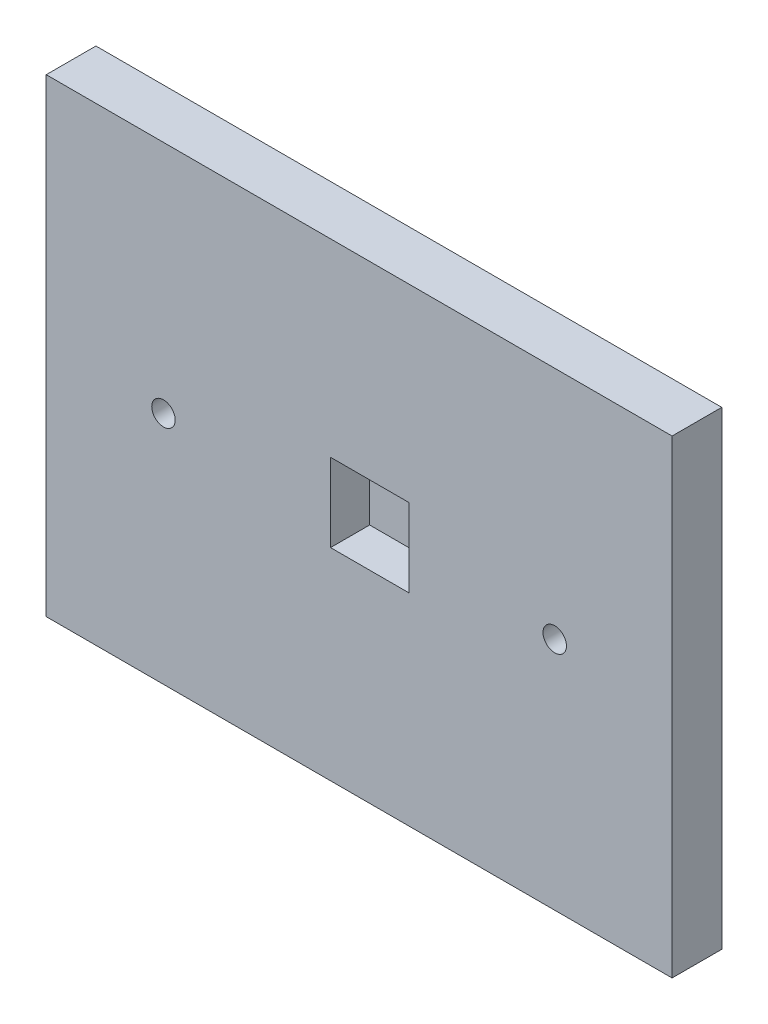
from build123d import *

# Parameters (mm, degrees)
SKETCH1_W           = 159.999934
SKETCH1_H           = 120
SKETCH1_R           = 3
BOSS_EXTRUDE1_DEPTH = 12.7
SKETCH3_W           = 20
SKETCH3_H           = 20
CUT_EXTRUDE3_DEPTH  = 10


with BuildPart() as part:
    # Sketch1 → Boss-Extrude1 (new body)
    with BuildSketch(Plane.XY):
        with Locations((47.542890143, -13.714285714)):
            Rectangle(SKETCH1_W, SKETCH1_H)
        with Locations(Location((97.542231184, -13.714285714, 0), (0, 0, 180))):
            Circle(SKETCH1_R, mode=Mode.SUBTRACT)
        with Locations(Location((-2.485927723, -13.714285714, 0), (0, 0, 180))):
            Circle(SKETCH1_R, mode=Mode.SUBTRACT)
    extrude(amount=BOSS_EXTRUDE1_DEPTH)

    # Sketch3 → Cut-Extrude3 (cut)
    with BuildSketch(Plane.XY.offset(12.7)):
        with Locations((50.220438118, -12.079110468)):
            Rectangle(SKETCH3_W, SKETCH3_H)
    extrude(amount=-CUT_EXTRUDE3_DEPTH, mode=Mode.SUBTRACT)


solid = part.part
